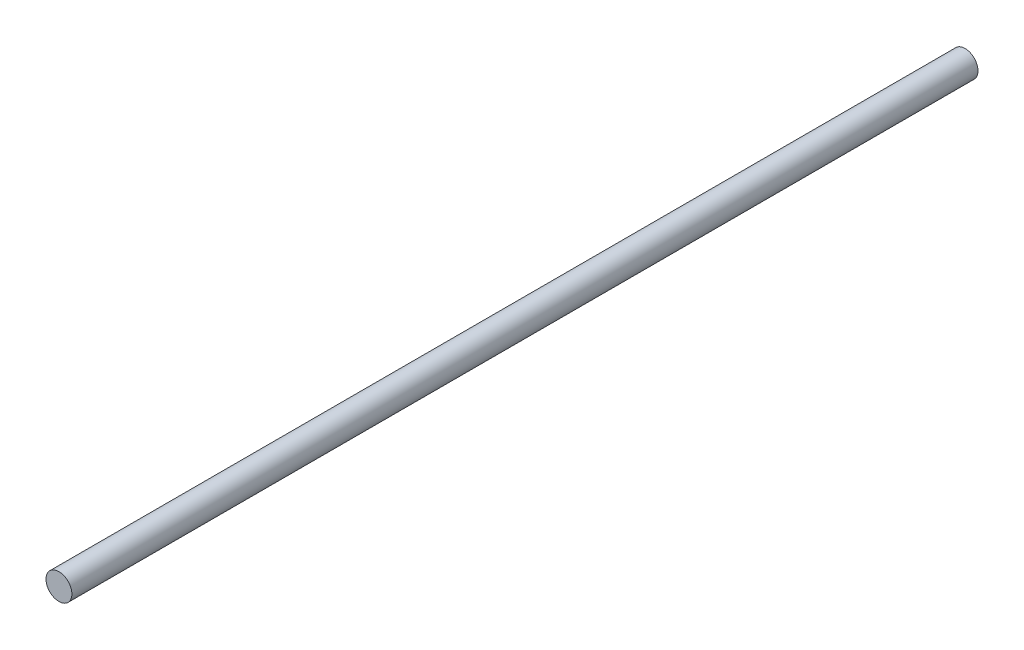
from build123d import *

# Parameters (mm, degrees)
SKETCH_1_R      = 4
EXTRUDE_1_DEPTH = 280


with BuildPart() as part:
    # 草圖1 → 填料-伸長1 (new body)
    with BuildSketch(Plane.XY):
        Circle(SKETCH_1_R)
    extrude(amount=EXTRUDE_1_DEPTH)


solid = part.part
